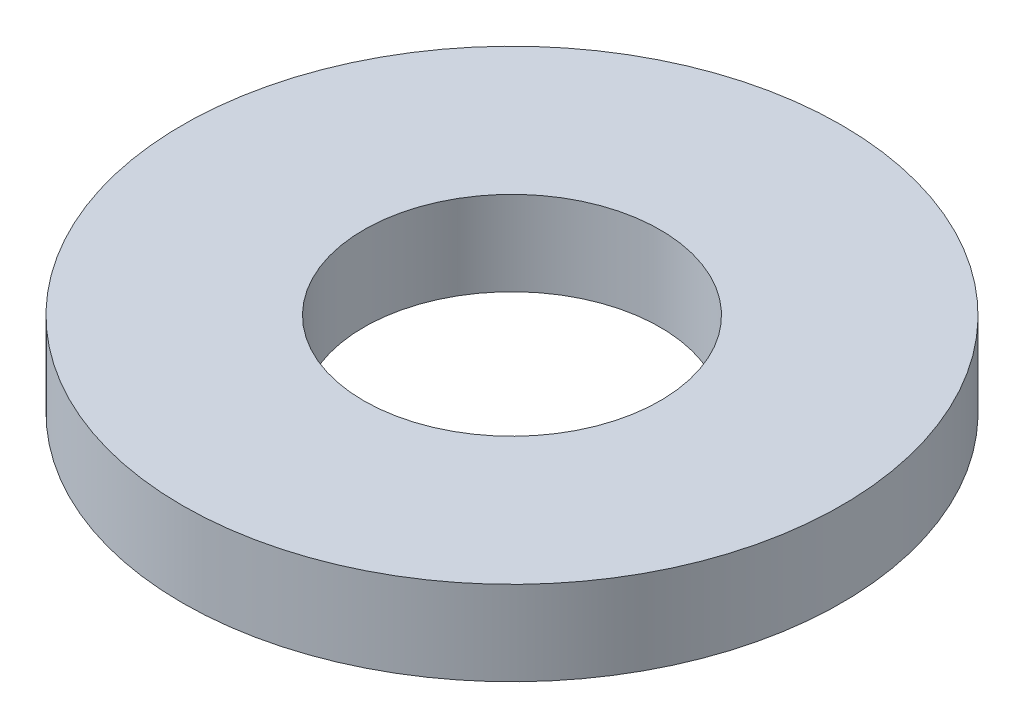
from build123d import *

# Parameters (mm, degrees)
SKETCH1_W = 4.3688
SKETCH1_H = 2.032


with BuildPart() as part:
    # Sketch1 → Revolve1 (revolve)
    with BuildSketch(Plane(origin=(0, 0, 0), x_dir=(-1, 0, 0), z_dir=(0, 0, -1)), mode=Mode.PRIVATE) as revolve1_sk:
        with Locations((-5.7531, 1.016)):
            Rectangle(SKETCH1_W, SKETCH1_H)
    revolve(revolve1_sk.sketch.rotate(Axis((0, 0, 0), (0, 1, 0)), 270), axis=Axis((0, 0, 0), (0, 1, 0)))


solid = part.part
